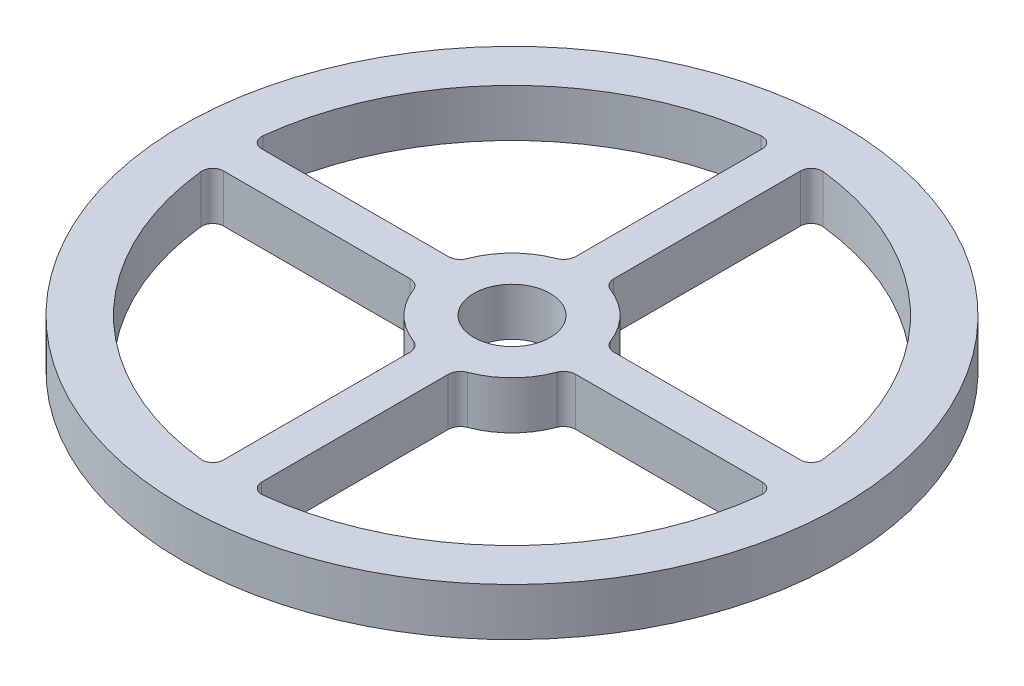
from build123d import *

# Parameters (mm, degrees)
SKETCH1_R           = 34.5
SKETCH1_R_2         = 4
BOSS_EXTRUDE1_DEPTH = 5
CUT_EXTRUDE2_DEPTH  = 50.045896872
CIRPATTERN1_COUNT   = 4


with BuildPart() as part:
    # Sketch1 → Boss-Extrude1 (new body)
    with BuildSketch(Plane(origin=(0, 0, 0), x_dir=(1, 0, 0), z_dir=(0, 1, 0))):
        with Locations(Location((0, 0, 0), (0, 0, 270))):
            Circle(SKETCH1_R)
        with Locations(Location((0, 0, 0), (0, 0, 270))):
            Circle(SKETCH1_R_2, mode=Mode.SUBTRACT)
    extrude(amount=BOSS_EXTRUDE1_DEPTH)

    # Sketch8 → Cut-Extrude2 (cut, through all)
    with BuildSketch(Plane(origin=(0, 5, 0), x_dir=(1, 0, 0), z_dir=(0, 1, 0))):
        with BuildLine():
            Line((-8.698076686, -2), (-28.201327726, -2))
            ThreePointArc((-28.201327726, -2), (-29.040208751, -2.374920589), (-29.320428032, -3.25))
            ThreePointArc((-29.320428032, -3.25), (-20.856955891, -20.862343851), (-3.242426547, -29.321266516))
            ThreePointArc((-3.242426547, -29.321266516), (-2.372627527, -29.04255234), (-2, -28.208657471))
            Line((-2, -28.208657471), (-2, -8.645966692))
            ThreePointArc((-2, -8.645966692), (-2.222589282, -7.955091785), (-2.787089084, -7.498808868))
            Line((-2.787089084, -7.498808868), (-2.857385295, -7.472305486))
            ThreePointArc((-2.857385295, -7.472305486), (-5.662928364, -5.650773606), (-7.478427834, -2.841323131))
            ThreePointArc((-7.478427834, -2.841323131), (-7.957237983, -2.230732861), (-8.698076686, -2))
        make_face()
    cut_extrude2 = extrude(amount=-CUT_EXTRUDE2_DEPTH, mode=Mode.SUBTRACT)

    # CirPattern1: Cut-Extrude2 ×4 about axis
    cirpattern1_axis = Axis((0, 0, 0), (0, 1, 0))
    for i in range(1, CIRPATTERN1_COUNT):
        add(cut_extrude2.rotate(cirpattern1_axis, i * 360 / CIRPATTERN1_COUNT), mode=Mode.SUBTRACT)


solid = part.part
